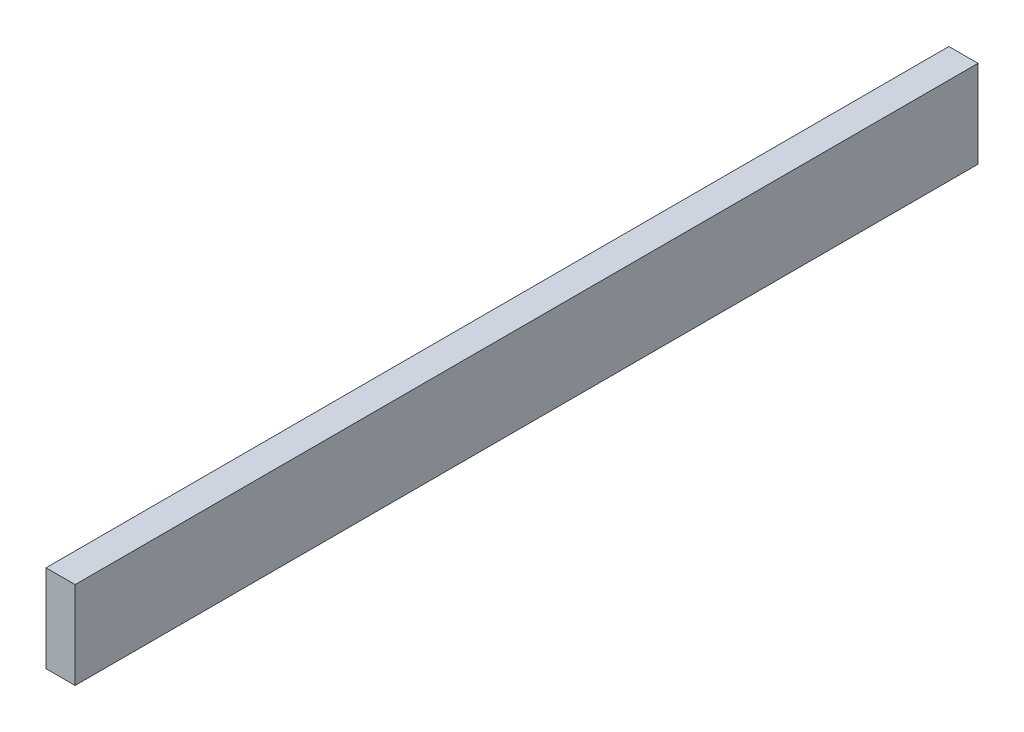
from build123d import *

# Parameters (mm, degrees)
SKETCH1_W           = 393.7
SKETCH1_H           = 38.1
BOSS_EXTRUDE1_DEPTH = 12.7


with BuildPart() as part:
    # Sketch1 → Boss-Extrude1 (new body)
    with BuildSketch(Plane(origin=(0, 0, 0), x_dir=(0, 0, -1), z_dir=(1, 0, 0))):
        with Locations((196.85, 19.05)):
            Rectangle(SKETCH1_W, SKETCH1_H)
    extrude(amount=BOSS_EXTRUDE1_DEPTH)


solid = part.part
